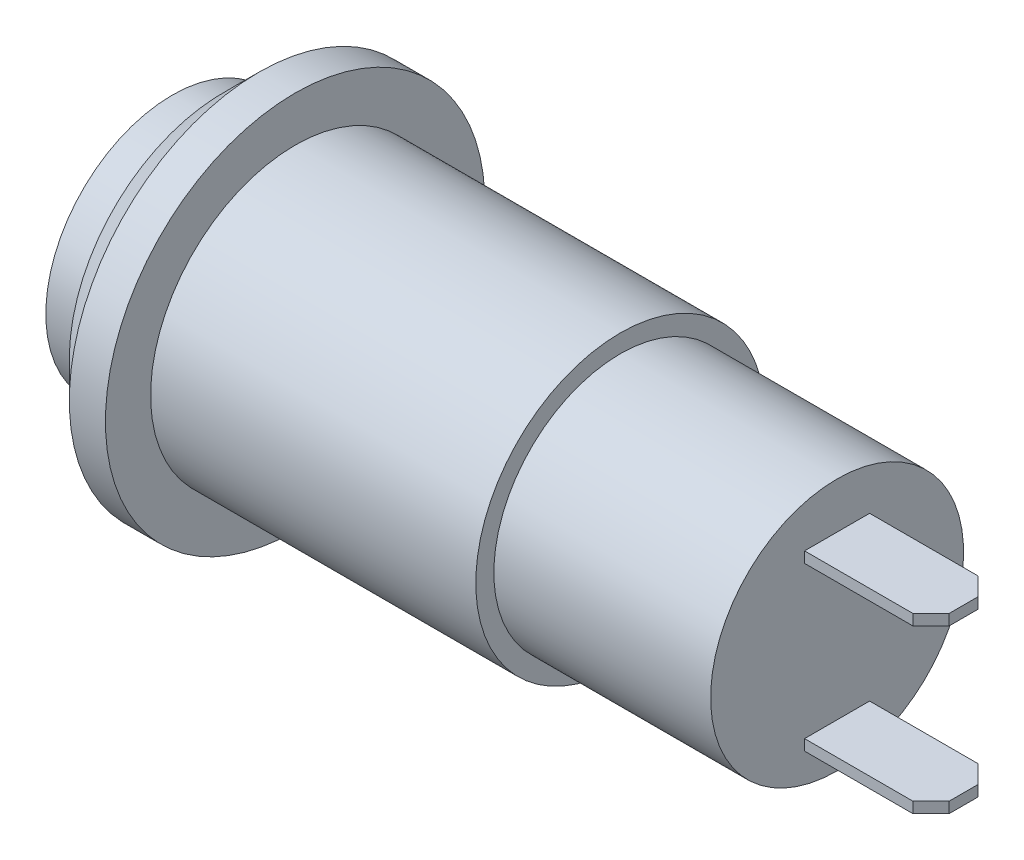
from build123d import *

# Parameters (mm, degrees)
CHAMFER_1_SIZE  = 1
SKETCH_2_W      = 1.8
SKETCH_2_H      = 0.3
EXTRUDE_1_DEPTH = 3.5
CHAMFER_2_SIZE  = 0.5


with BuildPart() as part:
    # 草图1 → 旋转1 (revolve)
    with BuildSketch(Plane.XY):
        Polygon((0, 0), (0, 3.5), (1.4, 3.5), (1.4, 5.25), (3.4, 5.25), (3.4, 4), (12.4, 4), (12.4, 3.5), (18.4, 3.5), (18.4, 0), align=None)
    revolve(axis=Axis((18.4, 0, 0), (-1, 0, 0)))

    # 倒角1
    chamfer_1_edges = [part.edges().sort_by_distance(p)[0] for p in [
        (1.4, -5.25, 0),
    ]]
    chamfer(chamfer_1_edges, length=CHAMFER_1_SIZE)

    # 草图2 → 凸台-拉伸1 (add)
    with BuildSketch(Plane(origin=(18.4, 0, 0), x_dir=(0, 0, -1), z_dir=(1, 0, 0))):
        with Locations((0, 2.075060306)):
            Rectangle(SKETCH_2_W, SKETCH_2_H)
        with Locations((0, -2.424939694)):
            Rectangle(SKETCH_2_W, SKETCH_2_H)
    extrude(amount=EXTRUDE_1_DEPTH)

    # 倒角2
    chamfer_2_edges = [part.edges().sort_by_distance(p)[0] for p in [
        (21.9, 2.075060306, 0.9),
        (21.9, 2.075060306, -0.9),
        (21.9, -2.424939694, 0.9),
        (21.9, -2.424939694, -0.9),
    ]]
    chamfer(chamfer_2_edges, length=CHAMFER_2_SIZE)


solid = part.part
